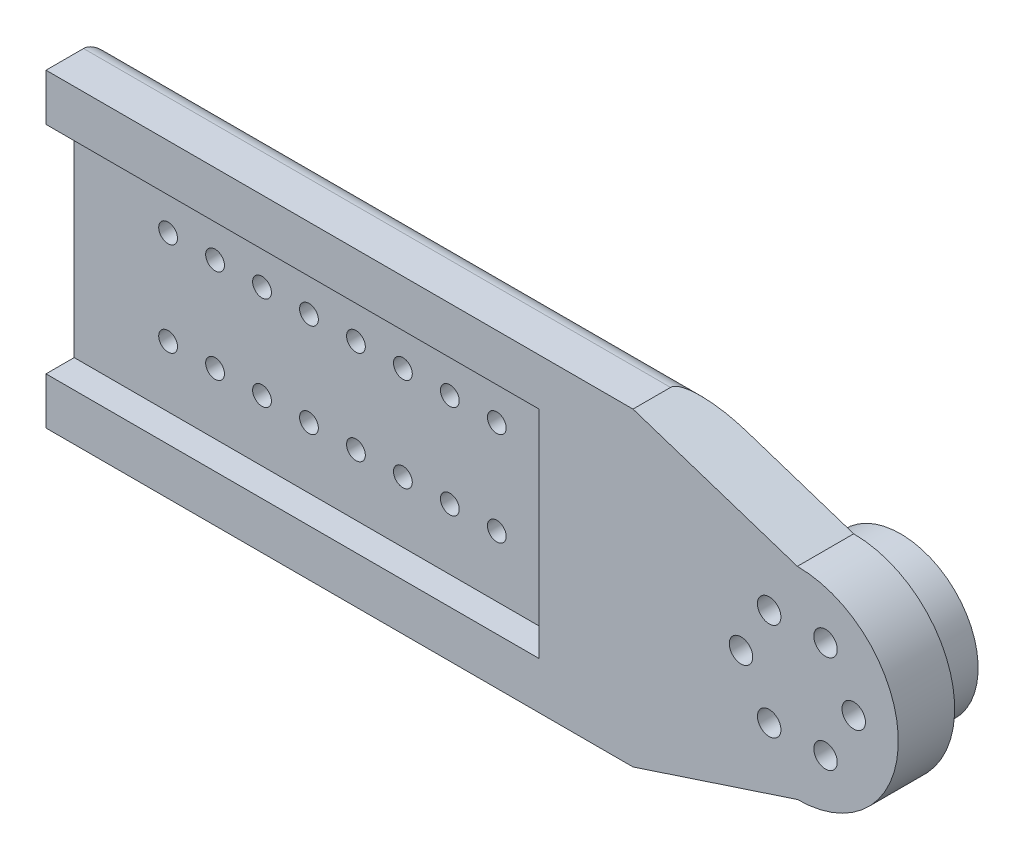
from build123d import *

# Parameters (mm, degrees)
SKETCH_1_R          = 2
EXTRUDE_1_DEPTH     = 12
SKETCH_6_R          = 16.5
EXTRUDE_3_DEPTH     = 10
SKETCH_7_R          = 2.5
CUT_EXTRUDE_3_DEPTH = 122.647030379
SKETCH_10_W         = 105
SKETCH_10_H         = 46
CUT_EXTRUDE_5_DEPTH = 6
FILLET_1_R          = 4


with BuildPart() as part:
    # 草图1 → 凸台-拉伸1 (new body)
    with BuildSketch(Plane.XY):
        with BuildLine():
            Line((10, -33), (-45, -33))
            Line((-45, -33), (-115, -33))
            Line((-115, -33), (-115, 33))
            Line((-115, 33), (-45, 33))
            Line((-45, 33), (10, 33))
            Line((10, 33), (45, 21.5))
            ThreePointArc((45, 21.5), (66.5, 0), (45, -21.5))
            Line((45, -21.5), (10, -33))
        make_face()
        with Locations((-35, 10)):
            Circle(SKETCH_1_R, mode=Mode.SUBTRACT)
        with Locations((-25, 10)):
            Circle(SKETCH_1_R, mode=Mode.SUBTRACT)
        with Locations((-25, -10)):
            Circle(SKETCH_1_R, mode=Mode.SUBTRACT)
        with Locations((-35, -10)):
            Circle(SKETCH_1_R, mode=Mode.SUBTRACT)
        with Locations((-55, 10)):
            Circle(SKETCH_1_R, mode=Mode.SUBTRACT)
        with Locations((-55, -10)):
            Circle(SKETCH_1_R, mode=Mode.SUBTRACT)
        with Locations((-45, -10)):
            Circle(SKETCH_1_R, mode=Mode.SUBTRACT)
        with Locations((-45, 10)):
            Circle(SKETCH_1_R, mode=Mode.SUBTRACT)
        with Locations((-75, 10)):
            Circle(SKETCH_1_R, mode=Mode.SUBTRACT)
        with Locations((-75, -10)):
            Circle(SKETCH_1_R, mode=Mode.SUBTRACT)
        with Locations((-65, -10)):
            Circle(SKETCH_1_R, mode=Mode.SUBTRACT)
        with Locations((-65, 10)):
            Circle(SKETCH_1_R, mode=Mode.SUBTRACT)
        with Locations((-95, 10)):
            Circle(SKETCH_1_R, mode=Mode.SUBTRACT)
        with Locations((-95, -10)):
            Circle(SKETCH_1_R, mode=Mode.SUBTRACT)
        with Locations((-85, -10)):
            Circle(SKETCH_1_R, mode=Mode.SUBTRACT)
        with Locations((-85, 10)):
            Circle(SKETCH_1_R, mode=Mode.SUBTRACT)
    extrude(amount=EXTRUDE_1_DEPTH)

    # 草图6 → 凸台-拉伸3 (add)
    with BuildSketch(Plane(origin=(0, 0, 0), x_dir=(-1, 0, 0), z_dir=(0, 0, -1))):
        with Locations((-45, 0)):
            Circle(SKETCH_6_R)
    extrude(amount=EXTRUDE_3_DEPTH)

    # 草图7 → 切除-拉伸3 (cut, through all)
    with BuildSketch(Plane(origin=(0, 0, -10), x_dir=(-1, 0, 0), z_dir=(0, 0, -1))):
        with Locations((-51, 10.392304845)):
            Circle(SKETCH_7_R)
        with Locations((-39, 10.392304845)):
            Circle(SKETCH_7_R)
        with Locations((-33, 0)):
            Circle(SKETCH_7_R)
        with Locations((-39, -10.392304845)):
            Circle(SKETCH_7_R)
        with Locations((-51, -10.392304845)):
            Circle(SKETCH_7_R)
        with Locations((-57, 0)):
            Circle(SKETCH_7_R)
    extrude(amount=-CUT_EXTRUDE_3_DEPTH, mode=Mode.SUBTRACT)

    # 草图10 → 切除-拉伸5 (cut)
    with BuildSketch(Plane.XY.offset(12)):
        with Locations((-62.5, 0)):
            Rectangle(SKETCH_10_W, SKETCH_10_H)
    extrude(amount=-CUT_EXTRUDE_5_DEPTH, mode=Mode.SUBTRACT)

    # 圆角1
    fillet_1_edges = [part.edges().sort_by_distance(p)[0] for p in [
        (-52.5, 33, 0),
        (-52.5, -33, 0),
        (-115, 0, 0),
    ]]
    fillet(fillet_1_edges, radius=FILLET_1_R)


solid = part.part
